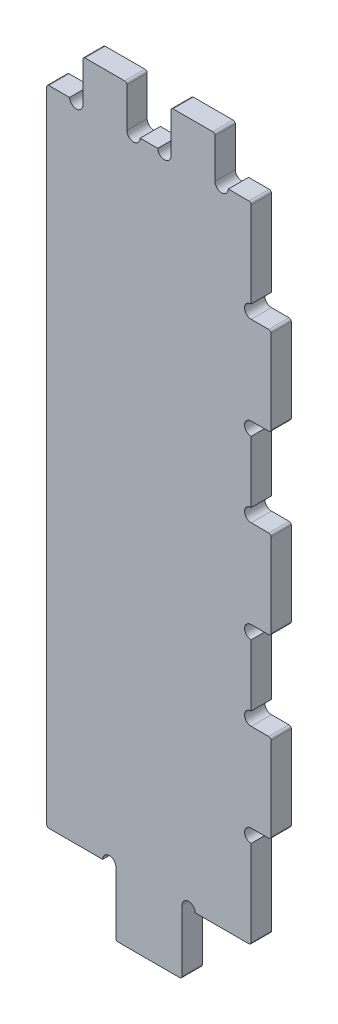
from build123d import *

# Parameters (mm, degrees)
BOSS_EXTRUDE1_DEPTH = 4.6
CUT_EXTRUDE1_DEPTH  = 164.683291756
FILLET1_R           = 0.5


with BuildPart() as part:
    # Sketch1 → Boss-Extrude1 (new body)
    with BuildSketch(Plane.XY):
        Polygon((8.2, 146), (8.2, 155.5), (18.2, 155.5), (18.2, 146), (28.2, 146), (28.2, 155.5), (38.2, 155.5), (38.2, 146), (46.4, 146), (46.4, 123), (50.9, 123), (50.9, 103), (46.4, 103), (46.4, 83), (50.9, 83), (50.9, 63), (46.4, 63), (46.4, 43), (50.9, 43), (50.9, 23), (46.4, 23), (46.4, 0), (30.7, 0), (30.7, -14.5), (15.7, -14.5), (15.7, 0), (0, 0), (0, 146), align=None)
    extrude(amount=BOSS_EXTRUDE1_DEPTH)

    # Sketch2 → Cut-Extrude1 (cut, through all)
    with BuildSketch(Plane.XY.offset(4.6)):
        with BuildLine():
            Line((15.7, 0), (15.7, -5))
            ThreePointArc((15.7, -5), (14.2, -6.5), (12.7, -5))
            Line((12.7, -5), (12.7, 0))
            ThreePointArc((12.7, 0), (14.2, 1.5), (15.7, 0))
        make_face()
        with BuildLine():
            Line((30.7, 0), (30.7, -5))
            ThreePointArc((30.7, -5), (32.2, -6.5), (33.7, -5))
            Line((33.7, -5), (33.7, 0))
            ThreePointArc((33.7, 0), (32.2, 1.5), (30.7, 0))
        make_face()
        with BuildLine():
            Line((46.4, 23), (50.9, 23))
            ThreePointArc((50.9, 23), (52.4, 21.5), (50.9, 20))
            Line((50.9, 20), (46.4, 20))
            ThreePointArc((46.4, 20), (44.9, 21.5), (46.4, 23))
        make_face()
        with BuildLine():
            Line((46.4, 63), (50.9, 63))
            ThreePointArc((50.9, 63), (52.4, 61.5), (50.9, 60))
            Line((50.9, 60), (46.4, 60))
            ThreePointArc((46.4, 60), (44.9, 61.5), (46.4, 63))
        make_face()
        with BuildLine():
            Line((46.4, 103), (50.9, 103))
            ThreePointArc((50.9, 103), (52.4, 101.5), (50.9, 100))
            Line((50.9, 100), (46.4, 100))
            ThreePointArc((46.4, 100), (44.9, 101.5), (46.4, 103))
        make_face()
        with BuildLine():
            Line((46.4, 43), (50.9, 43))
            ThreePointArc((50.9, 43), (52.4, 44.5), (50.9, 46))
            Line((50.9, 46), (46.4, 46))
            ThreePointArc((46.4, 46), (44.9, 44.5), (46.4, 43))
        make_face()
        with BuildLine():
            Line((46.4, 83), (50.9, 83))
            ThreePointArc((50.9, 83), (52.4, 84.5), (50.9, 86))
            Line((50.9, 86), (46.4, 86))
            ThreePointArc((46.4, 86), (44.9, 84.5), (46.4, 83))
        make_face()
        with BuildLine():
            Line((46.4, 123), (50.9, 123))
            ThreePointArc((50.9, 123), (52.4, 124.5), (50.9, 126))
            Line((50.9, 126), (46.4, 126))
            ThreePointArc((46.4, 126), (44.9, 124.5), (46.4, 123))
        make_face()
        with BuildLine():
            Line((38.2, 146), (38.2, 155.5))
            ThreePointArc((38.2, 155.5), (39.7, 157), (41.2, 155.5))
            Line((41.2, 155.5), (41.2, 146))
            ThreePointArc((41.2, 146), (39.7, 144.5), (38.2, 146))
        make_face()
        with BuildLine():
            Line((28.2, 146), (28.2, 155.5))
            ThreePointArc((28.2, 155.5), (26.7, 157), (25.2, 155.5))
            Line((25.2, 155.5), (25.2, 146))
            ThreePointArc((25.2, 146), (26.7, 144.5), (28.2, 146))
        make_face()
        with BuildLine():
            Line((8.2, 146), (8.2, 155.5))
            ThreePointArc((8.2, 155.5), (6.7, 157), (5.2, 155.5))
            Line((5.2, 155.5), (5.2, 146))
            ThreePointArc((5.2, 146), (6.7, 144.5), (8.2, 146))
        make_face()
        with BuildLine():
            Line((18.2, 146), (18.2, 155.5))
            ThreePointArc((18.2, 155.5), (19.7, 157), (21.2, 155.5))
            Line((21.2, 155.5), (21.2, 146))
            ThreePointArc((21.2, 146), (19.7, 144.5), (18.2, 146))
        make_face()
    extrude(amount=-CUT_EXTRUDE1_DEPTH, mode=Mode.SUBTRACT)

    # Fillet1
    fillet1_edges = [part.edges().sort_by_distance(p)[0] for p in [
        (0, 146, 2.3),
        (8.2, 155.5, 2.3),
        (18.2, 155.5, 2.3),
        (28.2, 155.5, 2.3),
        (38.2, 155.5, 2.3),
        (46.4, 146, 2.3),
        (50.9, 123, 2.3),
        (50.9, 103, 2.3),
        (50.9, 83, 2.3),
        (50.9, 63, 2.3),
        (50.9, 43, 2.3),
        (50.9, 23, 2.3),
        (46.4, 0, 2.3),
        (30.7, -14.5, 2.3),
        (15.7, -14.5, 2.3),
        (0, 0, 2.3),
    ]]
    fillet(fillet1_edges, radius=FILLET1_R)


solid = part.part
